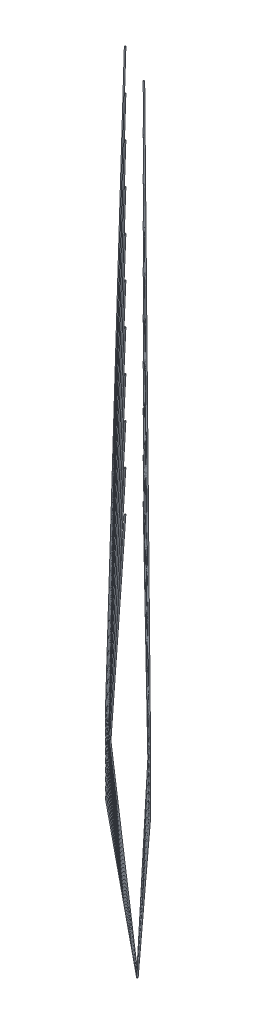
from build123d import *

# Parameters (mm, degrees)
SWEEP22_PROFILE_R = 0.75
SWEEP23_PROFILE_R = 0.75
SWEEP24_PROFILE_R = 0.75
SWEEP25_PROFILE_R = 0.75
SWEEP26_PROFILE_R = 0.75
SWEEP27_PROFILE_R = 0.75
SWEEP28_PROFILE_R = 0.75
SWEEP29_PROFILE_R = 0.75
SWEEP30_PROFILE_R = 0.75
SWEEP31_PROFILE_R = 0.75
SWEEP32_PROFILE_R = 0.75
SWEEP33_PROFILE_R = 0.75
SWEEP34_PROFILE_R = 0.75
SWEEP35_PROFILE_R = 0.75
SWEEP36_PROFILE_R = 0.75
SWEEP37_PROFILE_R = 0.75
SWEEP38_PROFILE_R = 0.75
SWEEP39_PROFILE_R = 0.75
SWEEP40_PROFILE_R = 0.75
SWEEP41_PROFILE_R = 0.75
SWEEP42_PROFILE_R = 0.75


with BuildPart() as part:
    # Sweep22: sweep along a curve in space
    with BuildLine() as sweep22_path:
        Line((0, -250, 12), (-30, -45, 25))
        Line((-30, -45, 25), (-13, 300, 16))
    # Sweep22 profile (on start of the path) → Sweep22 (sweep)
    with BuildSketch(Plane(origin=(0, -250, 12), x_dir=(0.9894610641341026, 0.14479918011718573, 0), z_dir=(-0.14451497465479335, 0.9875189934744213, 0.06262315568374378))):
        Circle(SWEEP22_PROFILE_R)
    sweep(path=sweep22_path.line, transition=Transition.RIGHT)


with BuildPart() as body_2:
    # Sweep23: sweep along a curve in space
    with BuildLine() as sweep23_path:
        Line((0, -250, 12), (-30, -34, 25))
        Line((-30, -34, 25), (-13, 356, 16))
    # Sweep23 profile (on start of the path) → Sweep23 (sweep)
    with BuildSketch(Plane(origin=(0, -250, 12), x_dir=(0.9904922731777516, 0.1375683712746877, 0), z_dir=(-0.1373245821369522, 0.9887369913860559, 0.05950731892601262))):
        Circle(SWEEP23_PROFILE_R)
    sweep(path=sweep23_path.line, transition=Transition.RIGHT)


with BuildPart() as body_3:
    # Sweep24: sweep along a curve in space
    with BuildLine() as sweep24_path:
        Line((0, -250, 12), (-30, -23, 25))
        Line((-30, -23, 25), (-13, 412, 16))
    # Sweep24 profile (on start of the path) → Sweep24 (sweep)
    with BuildSketch(Plane(origin=(0, -250, 12), x_dir=(0.9913798100566988, 0.13101935815727297, 0), z_dir=(-0.1308087029401943, 0.9897858522474704, 0.05668377127408421))):
        Circle(SWEEP24_PROFILE_R)
    sweep(path=sweep24_path.line, transition=Transition.RIGHT)


with BuildPart() as body_4:
    # Sweep25: sweep along a curve in space
    with BuildLine() as sweep25_path:
        Line((0, -250, 12), (-30, -12, 25))
        Line((-30, -12, 25), (-13, 468, 16))
    # Sweep25 profile (on start of the path) → Sweep25 (sweep)
    with BuildSketch(Plane(origin=(0, -250, 12), x_dir=(0.9921490786390947, 0.12506080823181867, 0), z_dir=(-0.12487756726527073, 0.9906953669711478, 0.054113612481617314))):
        Circle(SWEEP25_PROFILE_R)
    sweep(path=sweep25_path.line, transition=Transition.RIGHT)


with BuildPart() as body_5:
    # Sweep26: sweep along a curve in space
    with BuildLine() as sweep26_path:
        Line((0, -250, 12), (-30, -1, 25))
        Line((-30, -1, 25), (-13, 524, 16))
    # Sweep26 profile (on start of the path) → Sweep26 (sweep)
    with BuildSketch(Plane(origin=(0, -250, 12), x_dir=(0.9928201254014766, 0.11961688257849115, 0), z_dir=(-0.11945651462750372, 0.9914890714082808, 0.051764489671918275))):
        Circle(SWEEP26_PROFILE_R)
    sweep(path=sweep26_path.line, transition=Transition.RIGHT)


with BuildPart() as body_6:
    # Sweep27: sweep along a curve in space
    with BuildLine() as sweep27_path:
        Line((0, -250, 12), (-30, 10, 25))
        Line((-30, 10, 25), (-13, 580, 16))
    # Sweep27 profile (on start of the path) → Sweep27 (sweep)
    with BuildSketch(Plane(origin=(0, -250, 12), x_dir=(0.9934089358711312, 0.11462410798513052, 0), z_dir=(-0.1144829714633204, 0.9921857526821101, 0.049609287634105506))):
        Circle(SWEEP27_PROFILE_R)
    sweep(path=sweep27_path.line, transition=Transition.RIGHT)


with BuildPart() as body_7:
    # Sweep28: sweep along a curve in space
    with BuildLine() as sweep28_path:
        Line((0, -250, 12), (-30, 21, 25))
        Line((-30, 21, 25), (-13, 636, 16))
    # Sweep28 profile (on start of the path) → Sweep28 (sweep)
    with BuildSketch(Plane(origin=(0, -250, 12), x_dir=(0.9939283803781616, 0.11002897199758246, 0), z_dir=(-0.10990411994916797, 0.992800550207484, 0.047625118644639454))):
        Circle(SWEEP28_PROFILE_R)
    sweep(path=sweep28_path.line, transition=Transition.RIGHT)


with BuildPart() as body_8:
    # Sweep29: sweep along a curve in space
    with BuildLine() as sweep29_path:
        Line((0, -250, 12), (-30, 32, 25))
        Line((-30, 32, 25), (-13, 692, 16))
    # Sweep29 profile (on start of the path) → Sweep29 (sweep)
    with BuildSketch(Plane(origin=(0, -250, 12), x_dir=(0.9943889131791124, 0.10578605459352258, 0), z_dir=(-0.1056750820194165, 0.9933457709825152, 0.04579253554174715))):
        Circle(SWEEP29_PROFILE_R)
    sweep(path=sweep29_path.line, transition=Transition.RIGHT)


with BuildPart() as body_9:
    # Sweep30: sweep along a curve in space
    with BuildLine() as sweep30_path:
        Line((0, -250, 12), (-30, 43, 25))
        Line((-30, 43, 25), (-13, 748, 16))
    # Sweep30 profile (on start of the path) → Sweep30 (sweep)
    with BuildSketch(Plane(origin=(0, -250, 12), x_dir=(0.9947990956151798, 0.10185656269097404, 0), z_dir=(-0.1017574915280313, 0.993831500590439, 0.04409491299548023))):
        Circle(SWEEP30_PROFILE_R)
    sweep(path=sweep30_path.line, transition=Transition.RIGHT)


with BuildPart() as body_10:
    # Sweep31: sweep along a curve in space
    with BuildLine() as sweep31_path:
        Line((0, -250, 12), (-30, 54, 25))
        Line((-30, 54, 25), (-13, 804, 16))
    # Sweep31 profile (on start of the path) → Sweep31 (sweep)
    with BuildSketch(Plane(origin=(0, -250, 12), x_dir=(0.995165992037597, 0.09820717026686812, 0), z_dir=(-0.09811836179767335, 0.9942660662164232, 0.04251795677899178))):
        Circle(SWEEP31_PROFILE_R)
    sweep(path=sweep31_path.line, transition=Transition.RIGHT)


with BuildPart() as body_11:
    # Sweep32: sweep along a curve in space
    with BuildLine() as sweep32_path:
        Line((0, -250, 12), (-30, 65, 25))
        Line((-30, 65, 25), (-13, 860, 16))
    # Sweep32 profile (on start of the path) → Sweep32 (sweep)
    with BuildSketch(Plane(origin=(0, -250, 12), x_dir=(0.9954954725939523, 0.09480909262799546, 0), z_dir=(-0.09472918011025315, 0.994656391157658, 0.0410493113811097))):
        Circle(SWEEP32_PROFILE_R)
    sweep(path=sweep32_path.line, transition=Transition.RIGHT)


with BuildPart() as body_12:
    # Sweep33: sweep along a curve in space
    with BuildLine() as sweep33_path:
        Line((0, -250, 12), (30, -39.5, 25))
        Line((30, -39.5, 25), (13, 328, 16))
    # Sweep33 profile (on start of the path) → Sweep33 (sweep)
    with BuildSketch(Plane(origin=(0, -250, 12), x_dir=(0.9899964696308815, -0.1410921334390805, 0), z_dir=(0.1408291628931851, 0.9881512929671821, 0.06102597058704687))):
        Circle(SWEEP33_PROFILE_R)
    sweep(path=sweep33_path.line, transition=Transition.RIGHT)


with BuildPart() as body_13:
    # Sweep34: sweep along a curve in space
    with BuildLine() as sweep34_path:
        Line((0, -250, 12), (30, -28.5, 25))
        Line((30, -28.5, 25), (13, 384, 16))
    # Sweep34 profile (on start of the path) → Sweep34 (sweep)
    with BuildSketch(Plane(origin=(0, -250, 12), x_dir=(0.9909522691491238, -0.13421475428656307, 0), z_dir=(0.1339883342180221, 0.9892805343097296, 0.05806161149447623))):
        Circle(SWEEP34_PROFILE_R)
    sweep(path=sweep34_path.line, transition=Transition.RIGHT)


with BuildPart() as body_14:
    # Sweep35: sweep along a curve in space
    with BuildLine() as sweep35_path:
        Line((0, -250, 12), (30, -17.5, 25))
        Line((30, -17.5, 25), (13, 440, 16))
    # Sweep35 profile (on start of the path) → Sweep35 (sweep)
    with BuildSketch(Plane(origin=(0, -250, 12), x_dir=(0.9917778666340251, -0.1279713376301968, 0), z_dir=(0.12777502326103474, 0.9902564302730191, 0.05536917674644838))):
        Circle(SWEEP35_PROFILE_R)
    sweep(path=sweep35_path.line, transition=Transition.RIGHT)


with BuildPart() as body_15:
    # Sweep36: sweep along a curve in space
    with BuildLine() as sweep36_path:
        Line((0, -250, 12), (30, -6.5, 25))
        Line((30, -6.5, 25), (13, 496, 16))
    # Sweep36 profile (on start of the path) → Sweep36 (sweep)
    with BuildSketch(Plane(origin=(0, -250, 12), x_dir=(0.9924957979717628, -0.1222787430766032, 0), z_dir=(0.12210744449965585, 0.9911054245222067, 0.05291322594985087))):
        Circle(SWEEP36_PROFILE_R)
    sweep(path=sweep36_path.line, transition=Transition.RIGHT)


with BuildPart() as body_16:
    # Sweep37: sweep along a curve in space
    with BuildLine() as sweep37_path:
        Line((0, -250, 12), (30, 4.5, 25))
        Line((30, 4.5, 25), (13, 552, 16))
    # Sweep37 profile (on start of the path) → Sweep37 (sweep)
    with BuildSketch(Plane(origin=(0, -250, 12), x_dir=(0.9931239419611106, -0.11706765524099537, 0), z_dir=(0.11691731068198338, 0.991848518952159, 0.0506641679621928))):
        Circle(SWEEP37_PROFILE_R)
    sweep(path=sweep37_path.line, transition=Transition.RIGHT)


with BuildPart() as body_17:
    # Sweep38: sweep along a curve in space
    with BuildLine() as sweep38_path:
        Line((0, -250, 12), (30, 15.5, 25))
        Line((30, 15.5, 25), (13, 608, 16))
    # Sweep38 profile (on start of the path) → Sweep38 (sweep)
    with BuildSketch(Plane(origin=(0, -250, 12), x_dir=(0.9936766257044426, -0.11227984471236639, 0), z_dir=(0.11214718184631475, 0.9925025593398855, 0.04859711213340306))):
        Circle(SWEEP38_PROFILE_R)
    sweep(path=sweep38_path.line, transition=Transition.RIGHT)


with BuildPart() as body_18:
    # Sweep39: sweep along a curve in space
    with BuildLine() as sweep39_path:
        Line((0, -250, 12), (30, 26.5, 25))
        Line((30, 26.5, 25), (13, 664, 16))
    # Sweep39 profile (on start of the path) → Sweep39 (sweep)
    with BuildSketch(Plane(origin=(0, -250, 12), x_dir=(0.9941654364579972, -0.10786605097193458, 0), z_dir=(0.10774841026904777, 0.9930811813130569, 0.04669097778325403))):
        Circle(SWEEP39_PROFILE_R)
    sweep(path=sweep39_path.line, transition=Transition.RIGHT)


with BuildPart() as body_19:
    # Sweep40: sweep along a curve in space
    with BuildLine() as sweep40_path:
        Line((0, -250, 12), (30, 37.5, 25))
        Line((30, 37.5, 25), (13, 720, 16))
    # Sweep40 profile (on start of the path) → Sweep40 (sweep)
    with BuildSketch(Plane(origin=(0, -250, 12), x_dir=(0.9945998255205079, -0.10378432961953125, 0), z_dir=(0.10367953201321403, 0.9935955151266345, 0.04492779720572608))):
        Circle(SWEEP40_PROFILE_R)
    sweep(path=sweep40_path.line, transition=Transition.RIGHT)


with BuildPart() as body_20:
    # Sweep41: sweep along a curve in space
    with BuildLine() as sweep41_path:
        Line((0, -250, 12), (30, 48.5, 25))
        Line((30, 48.5, 25), (13, 776, 16))
    # Sweep41 profile (on start of the path) → Sweep41 (sweep)
    with BuildSketch(Plane(origin=(0, -250, 12), x_dir=(0.9949875627331983, -0.09999875002343701, 0), z_dir=(0.09990499666730639, 0.9940547168396986, 0.043292165222499436))):
        Circle(SWEEP41_PROFILE_R)
    sweep(path=sweep41_path.line, transition=Transition.RIGHT)


with BuildPart() as body_21:
    # Sweep42: sweep along a curve in space
    with BuildLine() as sweep42_path:
        Line((0, -250, 12), (30, 59.5, 25))
        Line((30, 59.5, 25), (13, 832, 16))
    # Sweep42 profile (on start of the path) → Sweep42 (sweep)
    with BuildSketch(Plane(origin=(0, -250, 12), x_dir=(0.9953350822820908, -0.09647836015658391, 0), z_dir=(0.09639415569882931, 0.9944663729595891, 0.04177080080282603))):
        Circle(SWEEP42_PROFILE_R)
    sweep(path=sweep42_path.line, transition=Transition.RIGHT)


solid = Compound([part.part, body_2.part, body_3.part, body_4.part, body_5.part, body_6.part, body_7.part, body_8.part, body_9.part, body_10.part, body_11.part, body_12.part, body_13.part, body_14.part, body_15.part, body_16.part, body_17.part, body_18.part, body_19.part, body_20.part, body_21.part])
